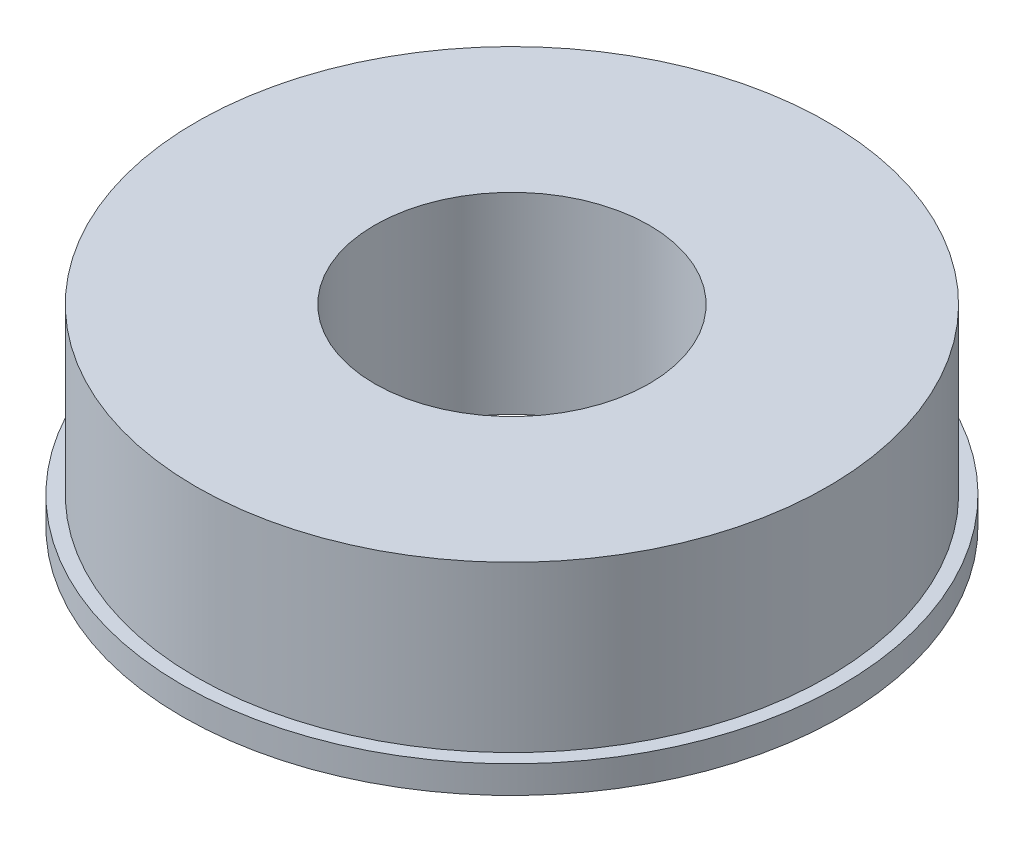
from build123d import *

# Parameters (mm, degrees)
SKETCH1_R           = 12
BOSS_EXTRUDE1_DEPTH = 7
SKETCH2_OUTSIDE_W   = 32.932
SKETCH2_OUTSIDE_H   = 32.932
SKETCH2_OUTSIDE_R   = 11.5
CUT_EXTRUDE3_DEPTH  = 6
CUT_EXTRUDE4_REACH  = 20.358
SKETCH3_R           = 5


with BuildPart() as part:
    # Sketch1 → Boss-Extrude1 (new body)
    with BuildSketch(Plane(origin=(0, 0, 0), x_dir=(1, 0, 0), z_dir=(0, 1, 0))):
        with Locations(Location((0, 0, 0), (0, 0, 270))):
            Circle(SKETCH1_R)
    extrude(amount=BOSS_EXTRUDE1_DEPTH)

    # Sketch2 outside → Cut-Extrude3 (cut)
    with BuildSketch(Plane(origin=(0, 7, 0), x_dir=(1, 0, 0), z_dir=(0, 1, 0))):
        Rectangle(SKETCH2_OUTSIDE_W, SKETCH2_OUTSIDE_H)
        with Locations(Location((0, 0, 0), (0, 0, 270))):
            Circle(SKETCH2_OUTSIDE_R, mode=Mode.SUBTRACT)
    extrude(amount=-CUT_EXTRUDE3_DEPTH, mode=Mode.SUBTRACT)

    # Sketch3 → Cut-Extrude4 (cut, up to next)
    with BuildSketch(Plane(origin=(0, 7, 0), x_dir=(1, 0, 0), z_dir=(0, 1, 0)), mode=Mode.PRIVATE) as cut_extrude4_sk1:
        with Locations(Location((0, 0, 0), (0, 0, 270))):
            Circle(SKETCH3_R)
    cut_extrude4_tool1 = extrude(cut_extrude4_sk1.sketch, amount=-CUT_EXTRUDE4_REACH, mode=Mode.PRIVATE) & part.part
    add(cut_extrude4_tool1.solids().sort_by_distance((0, 7, 0))[0], mode=Mode.SUBTRACT)


solid = part.part
